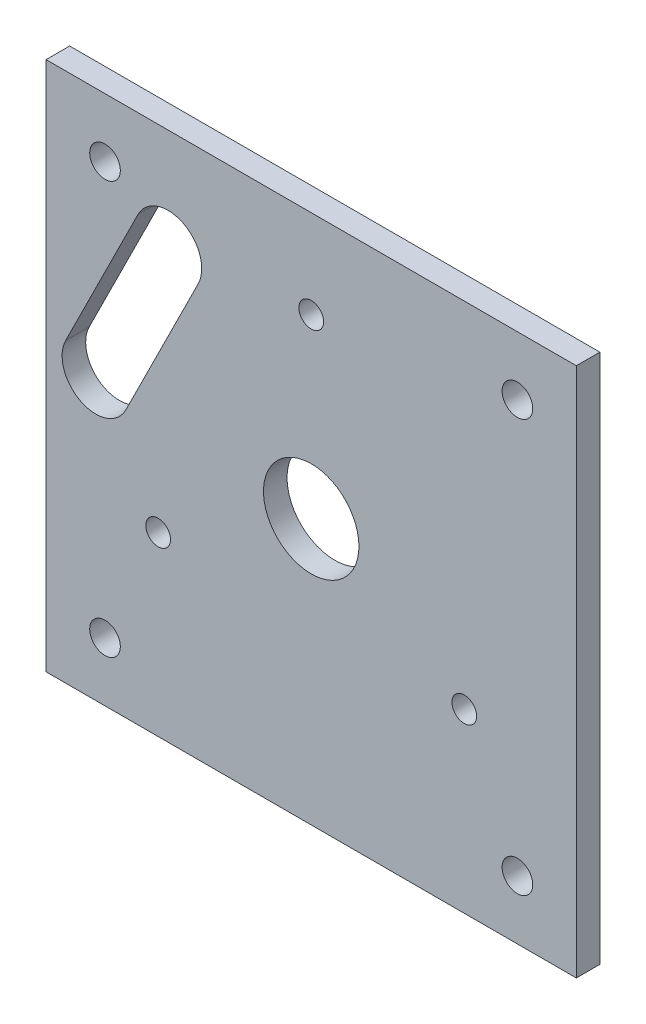
from build123d import *

# Parameters (mm, degrees)
SKETCH_1_R           = 2.5
SKETCH_1_R_2         = 8
EXTRUDE_1_DEPTH      = 2
SKETCH_2_R           = 34
CUT_EXTRUDE_1_DEPTH  = 0.5
SKETCH_3_R           = 2
CUT_EXTRUDE_2_DEPTH  = 28.5
SKETCH_5_R           = 2.1
CUT_EXTRUDE_3_DEPTH  = 10
SKETCH_4_R           = 2.6
CUT_EXTRUDE_4_DEPTH  = 10
SKETCH_7_W           = 125
SKETCH_7_H           = 125
SKETCH_7_W_2         = 80
SKETCH_7_H_2         = 80
EXTRUDE_2_DEPTH      = 2
SKETCH_8_R           = 2.760887892
EXTRUDE_3_DEPTH      = 2
SKETCH_9_R           = 2.6
CUT_EXTRUDE_5_DEPTH  = 2
CUT_EXTRUDE_7_DEPTH  = 2
EXTRUDE_START        = -2
SKETCH_11_W          = 250
SKETCH_11_H          = 250
SKETCH_11_R          = 2.1
SKETCH_11_R_2        = 8
EXTRUDE_4_DEPTH      = 2
SKETCH_13_R          = 2.6
CUT_EXTRUDE_9_DEPTH  = 51
SKETCH_16_R          = 34
CUT_EXTRUDE_11_DEPTH = 1
SKETCH_18_W          = 250
SKETCH_18_H          = 250
SKETCH_18_W_2        = 90
SKETCH_18_H_2        = 90
CUT_EXTRUDE_12_DEPTH = 10
SKETCH_20_R          = 2.6
CUT_EXTRUDE_14_DEPTH = 10
SKETCH_21_R          = 8.1
CUT_EXTRUDE_15_DEPTH = 10
SKETCH_24_R          = 34.1
CUT_EXTRUDE_17_DEPTH = 1
EXTRUDE_START_2      = 1
SKETCH_25_R          = 34.1
SKETCH_25_R_2        = 2.1
SKETCH_25_R_3        = 8.1
EXTRUDE_5_DEPTH      = 1
CUT_EXTRUDE_20_DEPTH = 10
SKETCH_31_W          = 90
SKETCH_31_H          = 90
SKETCH_31_R          = 2.1
SKETCH_31_R_2        = 8.1
SKETCH_31_R_3        = 2.6
EXTRUDE_6_DEPTH      = 4
EXTRUDE_START_3      = -4
EXTRUDE_7_DEPTH      = 4
CUT_EXTRUDE_21_DEPTH = 10


with BuildPart() as part:
    # 草图1 → 凸台-拉伸1 (new body)
    with BuildSketch(Plane.XY):
        Polygon((-33, 40), (-40, 40), (-40, 33), (-40, -33), (-40, -40), (40, -40), (40, 40), (33, 40), align=None)
        with Locations((-33, -33)):
            Circle(SKETCH_1_R, mode=Mode.SUBTRACT)
        with Locations((33, -30.5)):
            Circle(SKETCH_1_R, mode=Mode.SUBTRACT)
        Circle(SKETCH_1_R_2, mode=Mode.SUBTRACT)
        with Locations((-33, 33)):
            Circle(SKETCH_1_R, mode=Mode.SUBTRACT)
        with Locations((33, 33)):
            Circle(SKETCH_1_R, mode=Mode.SUBTRACT)
    extrude(amount=EXTRUDE_1_DEPTH)

    # 草图2 → 切除-拉伸1 (cut)
    with BuildSketch(Plane.XY.offset(2)):
        Circle(SKETCH_2_R)
    extrude(amount=-CUT_EXTRUDE_1_DEPTH, mode=Mode.SUBTRACT)

    # 草图3 → 切除-拉伸2 (cut)
    with BuildSketch(Plane.XY.offset(1.5)):
        with Locations((0, 30)):
            Circle(SKETCH_3_R)
        with Locations((25.980762114, -15)):
            Circle(SKETCH_3_R)
        with Locations((-25.980762114, -15)):
            Circle(SKETCH_3_R)
    extrude(amount=-CUT_EXTRUDE_2_DEPTH, mode=Mode.SUBTRACT)

    # 草图5 → 切除-拉伸3 (cut)
    with BuildSketch(Plane.XY.offset(1.5)):
        with Locations((25.980762114, -15)):
            Circle(SKETCH_5_R)
        with Locations((0, 30)):
            Circle(SKETCH_5_R)
        with Locations((-25.980762114, -15)):
            Circle(SKETCH_5_R)
    extrude(amount=-CUT_EXTRUDE_3_DEPTH, mode=Mode.SUBTRACT)

    # 草图4 → 切除-拉伸4 (cut)
    with BuildSketch(Plane.XY.offset(2)):
        with Locations((-33, 33)):
            Circle(SKETCH_4_R)
        with Locations((33, 33)):
            Circle(SKETCH_4_R)
        with Locations((33, -30.5)):
            Circle(SKETCH_4_R)
        with Locations((-33, -33)):
            Circle(SKETCH_4_R)
    extrude(amount=-CUT_EXTRUDE_4_DEPTH, mode=Mode.SUBTRACT)

    # 草图7 → 凸台-拉伸2 (add)
    with BuildSketch(Plane(origin=(0, 0, 0), x_dir=(-1, 0, 0), z_dir=(0, 0, -1))):
        Rectangle(SKETCH_7_W, SKETCH_7_H)
        Rectangle(SKETCH_7_W_2, SKETCH_7_H_2, mode=Mode.SUBTRACT)
    extrude(amount=-EXTRUDE_2_DEPTH)

    # 草图8 → 凸台-拉伸3 (add)
    with BuildSketch(Plane(origin=(0, 0, 0), x_dir=(-1, 0, 0), z_dir=(0, 0, -1))):
        with Locations((-33, -30.5)):
            Circle(SKETCH_8_R)
    extrude(amount=-EXTRUDE_3_DEPTH)

    # 草图9 → 切除-拉伸5 (cut)
    with BuildSketch(Plane(origin=(0, 0, 0), x_dir=(-1, 0, 0), z_dir=(0, 0, -1))):
        with Locations((-33, -34.063377391)):
            Circle(SKETCH_9_R)
    extrude(amount=-CUT_EXTRUDE_5_DEPTH, mode=Mode.SUBTRACT)

    # 草图10 → 切除-拉伸7 (cut)
    with BuildSketch(Plane(origin=(0, 0, 0), x_dir=(-1, 0, 0), z_dir=(0, 0, -1))):
        with BuildLine():
            Line((13.58008401, -47.982963501), (-13.58008401, -47.982963501))
            ThreePointArc((-13.58008401, -47.982963501), (-20.483293381, -41.079754129), (-13.58008401, -34.176544757))
            Line((-13.58008401, -34.176544757), (13.58008401, -34.176544757))
            ThreePointArc((13.58008401, -34.176544757), (20.483293381, -41.079754129), (13.58008401, -47.982963501))
        make_face()
    extrude(amount=-CUT_EXTRUDE_7_DEPTH, mode=Mode.SUBTRACT)

    # 草图11 → 凸台-拉伸4 (add)
    with BuildSketch(Plane(origin=(0, 0, 0), x_dir=(-1, 0, 0), z_dir=(0, 0, -1)).offset(EXTRUDE_START)):
        Rectangle(SKETCH_11_W, SKETCH_11_H)
        with Locations(Location((25.980762114, -15, 0), (0, 0, 180))):
            Circle(SKETCH_11_R, mode=Mode.SUBTRACT)
        Circle(SKETCH_11_R_2, mode=Mode.SUBTRACT)
        with Locations(Location((-25.980762114, -15, 0), (0, 0, 180))):
            Circle(SKETCH_11_R, mode=Mode.SUBTRACT)
        with Locations(Location((0, 30, 0), (0, 0, 180))):
            Circle(SKETCH_11_R, mode=Mode.SUBTRACT)
    extrude(amount=EXTRUDE_4_DEPTH)

    # 草图13 → 切除-拉伸9 (cut)
    with BuildSketch(Plane(origin=(0, 0, 0), x_dir=(-1, 0, 0), z_dir=(0, 0, -1))):
        with Locations((-105, 105)):
            Circle(SKETCH_13_R)
        with Locations((105, 105)):
            Circle(SKETCH_13_R)
        with Locations((-105, -105)):
            Circle(SKETCH_13_R)
        with Locations((105, -98.771678495)):
            Circle(SKETCH_13_R)
    extrude(amount=-CUT_EXTRUDE_9_DEPTH, mode=Mode.SUBTRACT)

    # 草图16 → 切除-拉伸11 (cut)
    with BuildSketch(Plane.XY.offset(2)):
        Circle(SKETCH_16_R)
    extrude(amount=-CUT_EXTRUDE_11_DEPTH, mode=Mode.SUBTRACT)

    # 草图18 → 切除-拉伸12 (cut)
    with BuildSketch(Plane(origin=(0, 0, 0), x_dir=(-1, 0, 0), z_dir=(0, 0, -1))):
        Rectangle(SKETCH_18_W, SKETCH_18_H)
        Rectangle(SKETCH_18_W_2, SKETCH_18_H_2, mode=Mode.SUBTRACT)
    extrude(amount=-CUT_EXTRUDE_12_DEPTH, mode=Mode.SUBTRACT)

    # 草图20 → 切除-拉伸14 (cut)
    with BuildSketch(Plane(origin=(0, 0, 0), x_dir=(-1, 0, 0), z_dir=(0, 0, -1))):
        with Locations((-35, 35)):
            Circle(SKETCH_20_R)
        with Locations((35, 35)):
            Circle(SKETCH_20_R)
        with Locations((35, -35)):
            Circle(SKETCH_20_R)
        with Locations((-35, -35)):
            Circle(SKETCH_20_R)
    extrude(amount=-CUT_EXTRUDE_14_DEPTH, mode=Mode.SUBTRACT)

    # 草图21 → 切除-拉伸15 (cut)
    with BuildSketch(Plane.XY.offset(1)):
        Circle(SKETCH_21_R)
    extrude(amount=-CUT_EXTRUDE_15_DEPTH, mode=Mode.SUBTRACT)

    # 草图24 → 切除-拉伸17 (cut)
    with BuildSketch(Plane.XY.offset(2)):
        Circle(SKETCH_24_R)
    extrude(amount=-CUT_EXTRUDE_17_DEPTH, mode=Mode.SUBTRACT)

    # 草图25 → 凸台-拉伸5 (add)
    with BuildSketch(Plane.XY.offset(1).offset(EXTRUDE_START_2)):
        Circle(SKETCH_25_R)
        with Locations((25.980762114, -15)):
            Circle(SKETCH_25_R_2, mode=Mode.SUBTRACT)
        with Locations((0, 30)):
            Circle(SKETCH_25_R_2, mode=Mode.SUBTRACT)
        Circle(SKETCH_25_R_3, mode=Mode.SUBTRACT)
        with Locations((-25.980762114, -15)):
            Circle(SKETCH_25_R_2, mode=Mode.SUBTRACT)
    extrude(amount=-EXTRUDE_5_DEPTH)

    # 草图30 → 切除-拉伸20 (cut)
    with BuildSketch(Plane(origin=(0, 0, 0), x_dir=(-1, 0, 0), z_dir=(0, 0, -1))):
        with BuildLine():
            Line((-34.25879914, 10.195171229), (-25.460402767, 24.557274857))
            ThreePointArc((-25.460402767, 24.557274857), (-19.205340885, 26.059890654), (-17.702725087, 19.804828771))
            Line((-17.702725087, 19.804828771), (-26.50112146, 5.442725143))
            ThreePointArc((-26.50112146, 5.442725143), (-32.756183343, 3.940109346), (-34.25879914, 10.195171229))
        make_face()
    extrude(amount=-CUT_EXTRUDE_20_DEPTH, mode=Mode.SUBTRACT)

    # 草图31 → 凸台-拉伸6 (add)
    with BuildSketch(Plane.XY):
        Rectangle(SKETCH_31_W, SKETCH_31_H)
        with Locations((-25.980762114, -15)):
            Circle(SKETCH_31_R, mode=Mode.SUBTRACT)
        Circle(SKETCH_31_R_2, mode=Mode.SUBTRACT)
        with Locations((0, 30)):
            Circle(SKETCH_31_R, mode=Mode.SUBTRACT)
        with Locations((25.980762114, -15)):
            Circle(SKETCH_31_R, mode=Mode.SUBTRACT)
        with Locations(Location((-35, 35, 0), (0, 0, 180))):
            Circle(SKETCH_31_R_3, mode=Mode.SUBTRACT)
        with Locations(Location((35, 35, 0), (0, 0, 180))):
            Circle(SKETCH_31_R_3, mode=Mode.SUBTRACT)
        with Locations(Location((-35, -35, 0), (0, 0, 180))):
            Circle(SKETCH_31_R_3, mode=Mode.SUBTRACT)
        with Locations(Location((35, -35, 0), (0, 0, 180))):
            Circle(SKETCH_31_R_3, mode=Mode.SUBTRACT)
        with BuildLine():
            Line((17.702725087, 19.804828771), (26.50112146, 5.442725143))
            ThreePointArc((26.50112146, 5.442725143), (32.756183343, 3.940109346), (34.25879914, 10.195171229))
            Line((34.25879914, 10.195171229), (25.460402767, 24.557274857))
            ThreePointArc((25.460402767, 24.557274857), (19.205340885, 26.059890654), (17.702725087, 19.804828771))
        make_face(mode=Mode.SUBTRACT)
    extrude(amount=EXTRUDE_6_DEPTH)

    # 草图32 → 凸台-拉伸7 (add)
    with BuildSketch(Plane.XY.offset(4).offset(EXTRUDE_START_3)):
        with BuildLine():
            Line((17.702725087, 19.804828771), (26.50112146, 5.442725143))
            ThreePointArc((26.50112146, 5.442725143), (32.756183343, 3.940109346), (34.25879914, 10.195171229))
            Line((34.25879914, 10.195171229), (25.460402767, 24.557274857))
            ThreePointArc((25.460402767, 24.557274857), (19.205340885, 26.059890654), (17.702725087, 19.804828771))
        make_face()
    extrude(amount=EXTRUDE_7_DEPTH)

    # 草图33 → 切除-拉伸21 (cut)
    with BuildSketch(Plane(origin=(0, 0, 0), x_dir=(-1, 0, 0), z_dir=(0, 0, -1))):
        with BuildLine():
            Line((31.466175781, 0.279206161), (19.18721424, 24.940909849))
            ThreePointArc((19.18721424, 24.940909849), (21.75266604, 32.594262797), (29.406018987, 30.028810997))
            Line((29.406018987, 30.028810997), (41.684980529, 5.367107309))
            ThreePointArc((41.684980529, 5.367107309), (39.119528729, -2.286245639), (31.466175781, 0.279206161))
        make_face()
    extrude(amount=-CUT_EXTRUDE_21_DEPTH, mode=Mode.SUBTRACT)


solid = part.part
